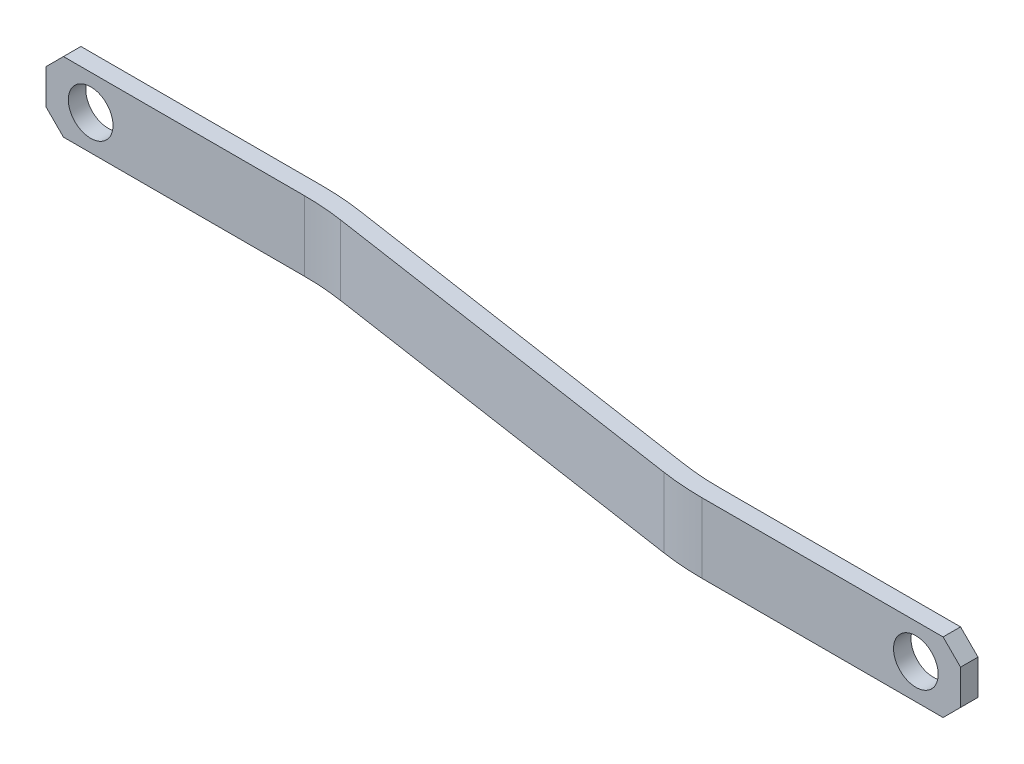
from build123d import *

# Parameters (mm, degrees)
SKETCH1_W          = 177.8
SKETCH1_H          = 12.7
BASE_EXTRUDE_DEPTH = 14.605
EXTRUDE1_DEPTH     = 50.8
SKETCH2_R          = 4.064
CUT_EXTRUDE1_DEPTH = 179.619077648
SKETCH3_R          = 4.064
CUT_EXTRUDE2_DEPTH = 187.071516925
CHAMFER1_SIZE      = 3.175
CHAMFER2_SIZE      = 3.175


with BuildPart() as part:
    # Sketch1 → Base-Extrude (new body)
    with BuildSketch(Plane.XY):
        with Locations((88.9, 6.35)):
            Rectangle(SKETCH1_W, SKETCH1_H)
    extrude(amount=BASE_EXTRUDE_DEPTH)


with BuildPart() as body_2:
    # Sketch5 → Extrude1 (new body)
    with BuildSketch(Plane(origin=(0, 12.7, 0), x_dir=(-1, 0, 0), z_dir=(0, 1, 0))):
        with BuildLine():
            Line((0, 0), (-47.022766551, 0))
            ThreePointArc((-47.022766551, 0), (-50.789601569, 0.139848461), (-54.535696978, 0.55862386))
            Line((-54.535696978, 0.55862386), (-123.733861174, 10.906290131))
            ThreePointArc((-123.733861174, 10.906290131), (-127.245825619, 11.298892068), (-130.777233449, 11.43))
            Line((-130.777233449, 11.43), (-177.8, 11.43))
            Line((-177.8, 11.43), (-177.8, 14.605))
            Line((-177.8, 14.605), (-130.777233449, 14.605))
            ThreePointArc((-130.777233449, 14.605), (-127.010398431, 14.465151539), (-123.264303022, 14.04637614))
            Line((-123.264303022, 14.04637614), (-54.066138826, 3.698709869))
            ThreePointArc((-54.066138826, 3.698709869), (-50.554174381, 3.306107932), (-47.022766551, 3.175))
            Line((-47.022766551, 3.175), (0, 3.175))
            Line((0, 3.175), (0, 0))
        make_face()
    extrude(amount=-EXTRUDE1_DEPTH)


with BuildPart() as part_1:
    add(part.part)

    # Combine1: intersect body 2
    add(body_2.part, mode=Mode.INTERSECT)

    # Sketch2 → Cut-Extrude1 (cut, through all)
    with BuildSketch(Plane.XY.offset(3.175)):
        with Locations((8.128, 6.35)):
            Circle(SKETCH2_R)
    extrude(amount=-CUT_EXTRUDE1_DEPTH, mode=Mode.SUBTRACT)

    # Sketch3 → Cut-Extrude2 (cut, through all)
    with BuildSketch(Plane(origin=(185.269572221, -0.228654981, 11.43), x_dir=(1, 0, 0), z_dir=(0, 0, 1))):
        with Locations((-15.597572221, 6.578654981)):
            Circle(SKETCH3_R)
    extrude(amount=CUT_EXTRUDE2_DEPTH, mode=Mode.SUBTRACT)

    # Chamfer1
    chamfer1_edges = [part_1.edges().sort_by_distance(p)[0] for p in [
        (177.8, 12.7, 13.0175),
        (177.8, 0, 13.0175),
    ]]
    chamfer(chamfer1_edges, length=CHAMFER1_SIZE)

    # Chamfer2
    chamfer2_edges = [part_1.edges().sort_by_distance(p)[0] for p in [
        (0, 12.7, 1.5875),
        (0, 0, 1.5875),
    ]]
    chamfer(chamfer2_edges, length=CHAMFER2_SIZE)


solid = part_1.part
